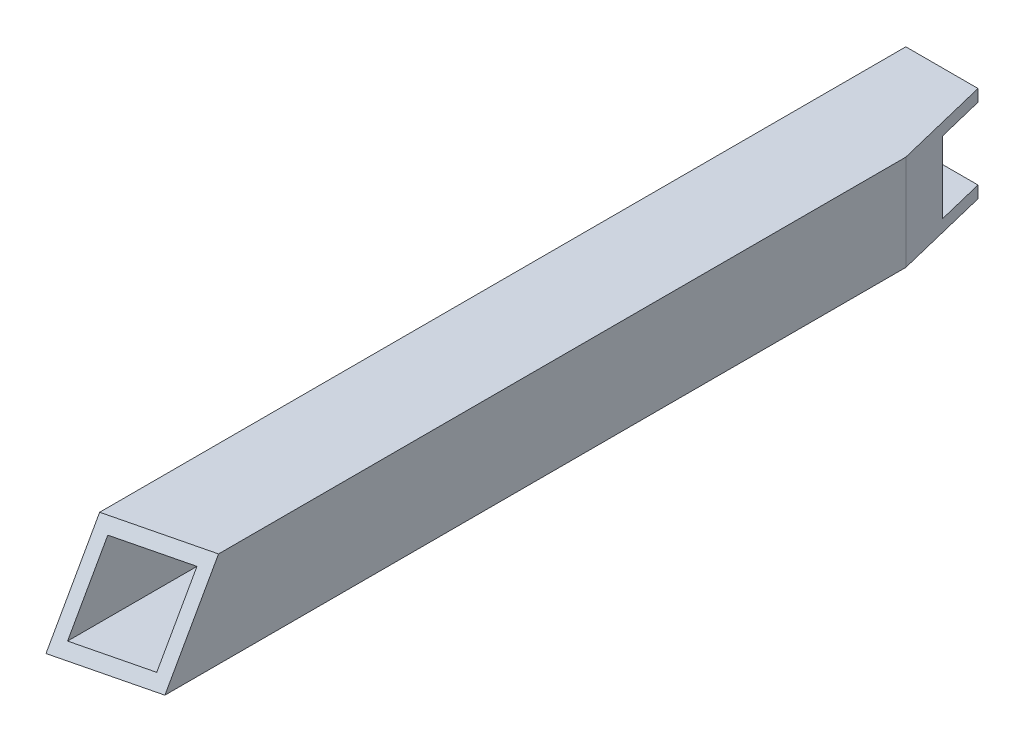
from build123d import *

# Parameters (mm, degrees)
BOSS_EXTRUDE1_DEPTH      = 114.3
BOSS_EXTRUDE1_DEPTH_BACK = 114.3
SKETCH3_W                = 25.4
SKETCH3_H                = 25.4
SKETCH3_W_2              = 19.05
SKETCH3_H_2              = 19.05


with BuildPart() as part:
    # Sketch3 → Boss-Extrude1 (new, two sides: drawn at the far end of the back side and taken through both)
    with BuildSketch(Plane.XY.offset(-BOSS_EXTRUDE1_DEPTH_BACK)):
        Rectangle(SKETCH3_W, SKETCH3_H)
        Rectangle(SKETCH3_W_2, SKETCH3_H_2, mode=Mode.SUBTRACT)
    extrude(amount=BOSS_EXTRUDE1_DEPTH + BOSS_EXTRUDE1_DEPTH_BACK)

    # SurfaceCut2
    split(bisect_by=Plane(origin=(18.506664542, 42.493539826, 75.67626096), x_dir=(0.9713752475559996, 0, -0.2375502650714591), z_dir=(0.20854523863616634, 0.47884508758591265, 0.8527697611530466)), keep=Keep.BOTTOM)

    # SurfaceCut4
    split(bisect_by=Plane(origin=(32.497052155, 0, -7.947169102), x_dir=(0, 1, 0), z_dir=(0.9713752475559998, 0, -0.23755026507145854)), keep=Keep.BOTTOM)


solid = part.part
